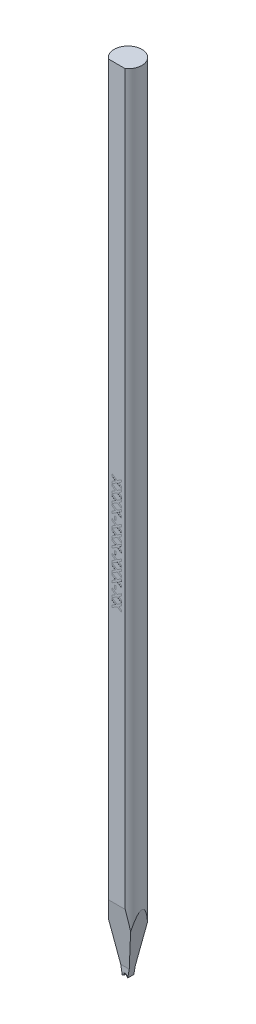
from build123d import *

# Parameters (mm, degrees)
SKETCH_TL_CUTTING_R       = 1.4986
TL_CUTTING_DEPTH          = 85.4964
SKETCH_TDF_GRINDING_W     = 3.0172
SKETCH_TDF_GRINDING_H     = 3.0172
TDF_GRINDING_DEPTH        = 86.522663762
SKETCH_ENGRAVING_W        = 0.166666667
SKETCH_ENGRAVING_H        = 0.371794872
ENGRAVING_DEPTH           = 0.005
VW_VR_GRINDING_DEPTH      = 1.5086
VW_VR_GRINDING_DEPTH_BACK = 1.5086
ISA_GRINDING_DEPTH        = 1.5086
ISA_GRINDING_DEPTH_BACK   = 1.5086
PRE_FRX_BRX_DEPTH         = 1.5086
PRE_FRX_BRX_DEPTH_BACK    = 1.5086
SKETCH_PRE_FRX_BRX_W      = 1.18348
SKETCH_PRE_FRX_BRX_H      = 0.89916
FR_EDM_R                  = 0.14986
BR_EDM_R                  = 0.14986
FA_BA_GRINDING_DEPTH      = 1.5086
FA_BA_GRINDING_DEPTH_BACK = 1.5086


with BuildPart() as part:
    # sketch_TL_cutting → TL_cutting (new body)
    with BuildSketch(Plane(origin=(0, 0, 0), x_dir=(1, 0, 0), z_dir=(0, 1, 0))):
        Circle(SKETCH_TL_CUTTING_R)
    extrude(amount=TL_CUTTING_DEPTH)

    # sketch_TDF_grinding → TDF_grinding (cut, through all)
    with BuildSketch(Plane(origin=(0, 0, 0), x_dir=(1, 0, 0), z_dir=(0, 1, 0))):
        with Locations((0, -2.71002)):
            Rectangle(SKETCH_TDF_GRINDING_W, SKETCH_TDF_GRINDING_H)
    extrude(amount=TDF_GRINDING_DEPTH, mode=Mode.SUBTRACT)

    # sketch_engraving → engraving (cut)
    with BuildSketch(Plane.XY.offset(1.20142)):
        Polygon((-0.5, 47.016609744), (0.029647436, 46.673861346), (0.5, 46.978148205), (0.5, 46.75338859), (0.203325321, 46.561481538), (0.5, 46.369574487), (0.5, 46.144814872), (0.029647436, 46.449101731), (-0.5, 46.106353333), (-0.5, 46.331112949), (-0.144030449, 46.561481538), (-0.5, 46.791850128), align=None)
        Polygon((-0.5, 46.093532821), (0.029647436, 45.750784423), (0.5, 46.055071282), (0.5, 45.830311667), (0.203325321, 45.638404615), (0.5, 45.446497564), (0.5, 45.221737949), (0.029647436, 45.526024808), (-0.5, 45.18327641), (-0.5, 45.408036026), (-0.144030449, 45.638404615), (-0.5, 45.868773205), align=None)
        Polygon((-0.5, 45.170455897), (0.029647436, 44.8277075), (0.5, 45.131994359), (0.5, 44.907234744), (0.203325321, 44.715327692), (0.5, 44.523420641), (0.5, 44.298661026), (0.029647436, 44.602947885), (-0.5, 44.260199487), (-0.5, 44.484959103), (-0.144030449, 44.715327692), (-0.5, 44.945696282), align=None)
        Polygon((-0.5, 44.247378974), (0.029647436, 43.904630577), (0.5, 44.208917436), (0.5, 43.984157821), (0.203325321, 43.792250769), (0.5, 43.600343718), (0.5, 43.375584103), (0.029647436, 43.679870962), (-0.5, 43.337122564), (-0.5, 43.561882179), (-0.144030449, 43.792250769), (-0.5, 44.022619359), align=None)
        with Locations((-0.147435898, 43.067891795)):
            Rectangle(SKETCH_ENGRAVING_W, SKETCH_ENGRAVING_H)
        Polygon((-0.5, 42.86276359), (0.029647436, 42.520015192), (0.5, 42.824302051), (0.5, 42.599542436), (0.203325321, 42.407635385), (0.5, 42.215728333), (0.5, 41.990968718), (0.029647436, 42.295255577), (-0.5, 41.952507179), (-0.5, 42.177266795), (-0.144030449, 42.407635385), (-0.5, 42.638003974), align=None)
        Polygon((-0.5, 41.939686667), (0.029647436, 41.596938269), (0.5, 41.901225128), (0.5, 41.676465513), (0.203325321, 41.484558462), (0.5, 41.29265141), (0.5, 41.067891795), (0.029647436, 41.372178654), (-0.5, 41.029430256), (-0.5, 41.254189872), (-0.144030449, 41.484558462), (-0.5, 41.714927051), align=None)
        Polygon((-0.5, 41.016609744), (0.029647436, 40.673861346), (0.5, 40.978148205), (0.5, 40.75338859), (0.203325321, 40.561481538), (0.5, 40.369574487), (0.5, 40.144814872), (0.029647436, 40.449101731), (-0.5, 40.106353333), (-0.5, 40.331112949), (-0.144030449, 40.561481538), (-0.5, 40.791850128), align=None)
        with Locations((-0.147435898, 39.837122564)):
            Rectangle(SKETCH_ENGRAVING_W, SKETCH_ENGRAVING_H)
        Polygon((-0.5, 39.631994359), (0.029647436, 39.289245962), (0.5, 39.593532821), (0.5, 39.368773205), (0.203325321, 39.176866154), (0.5, 38.984959103), (0.5, 38.760199487), (0.029647436, 39.064486346), (-0.5, 38.721737949), (-0.5, 38.946497564), (-0.144030449, 39.176866154), (-0.5, 39.407234744), align=None)
        Polygon((-0.5, 38.708917436), (0.029647436, 38.366169038), (0.5, 38.670455897), (0.5, 38.445696282), (0.203325321, 38.253789231), (0.5, 38.061882179), (0.5, 37.837122564), (0.029647436, 38.141409423), (-0.5, 37.798661026), (-0.5, 38.023420641), (-0.144030449, 38.253789231), (-0.5, 38.484157821), align=None)
        Polygon((-0.5, 37.785840513), (0.029647436, 37.443092115), (0.5, 37.747378974), (0.5, 37.522619359), (0.203325321, 37.330712308), (0.5, 37.138805256), (0.5, 36.914045641), (0.029647436, 37.2183325), (-0.5, 36.875584103), (-0.5, 37.100343718), (-0.144030449, 37.330712308), (-0.5, 37.561080897), align=None)
        with Locations((-0.147435898, 36.606353333)):
            Rectangle(SKETCH_ENGRAVING_W, SKETCH_ENGRAVING_H)
        Polygon((-0.5, 36.401225128), (0.029647436, 36.058476731), (0.5, 36.36276359), (0.5, 36.138003974), (0.203325321, 35.946096923), (0.5, 35.754189872), (0.5, 35.529430256), (0.029647436, 35.833717115), (-0.5, 35.490968718), (-0.5, 35.715728333), (-0.144030449, 35.946096923), (-0.5, 36.176465513), align=None)
        Polygon((-0.5, 35.478148205), (0.029647436, 35.135399808), (0.5, 35.439686667), (0.5, 35.214927051), (0.203325321, 35.02302), (0.5, 34.831112949), (0.5, 34.606353333), (0.029647436, 34.910640192), (-0.5, 34.567891795), (-0.5, 34.79265141), (-0.144030449, 35.02302), (-0.5, 35.25338859), align=None)
    extrude(amount=-ENGRAVING_DEPTH, mode=Mode.SUBTRACT)

    # sketch_VW_VR_grinding → VW_VR_grinding (cut, two sides: drawn at the far end of the back side and taken through both)
    with BuildSketch(Plane.XY.offset(-VW_VR_GRINDING_DEPTH_BACK)):
        with BuildLine():
            Line((-1.4936, -0.01), (-1.4936, 0.88416))
            ThreePointArc((-1.4936, 0.88416), (-1.495064466, 0.887695534), (-1.4986, 0.88916))
            Line((-1.4986, 0.88916), (-1.5086, 0.88916))
            Line((-1.5086, 0.88916), (-1.5086, -0.01))
            Line((-1.5086, -0.01), (-1.4936, -0.01))
        make_face()
        with BuildLine():
            Line((1.4936, -0.01), (1.4936, 0.88416))
            ThreePointArc((1.4936, 0.88416), (1.495064466, 0.887695534), (1.4986, 0.88916))
            Line((1.4986, 0.88916), (1.5086, 0.88916))
            Line((1.5086, 0.88916), (1.5086, -0.01))
            Line((1.5086, -0.01), (1.4936, -0.01))
        make_face()
    extrude(amount=VW_VR_GRINDING_DEPTH + VW_VR_GRINDING_DEPTH_BACK, mode=Mode.SUBTRACT)

    # sketch_ISA_grinding → ISA_grinding (cut, two sides: drawn at the far end of the back side and taken through both)
    with BuildSketch(Plane.XY.offset(-ISA_GRINDING_DEPTH_BACK)):
        Polygon((-0.29972, 0), (-1.5086, 6.855899166), (-1.5086, -0.01), (1.5086, -0.01), (1.5086, 6.855899166), (0.29972, 0), align=None)
    extrude(amount=ISA_GRINDING_DEPTH + ISA_GRINDING_DEPTH_BACK, mode=Mode.SUBTRACT)

    # sketch_pre_FRX_BRX → pre_FRX_BRX (cut, two sides: drawn at the far end of the back side and taken through both)
    with BuildSketch(Plane(origin=(0, 0, 0), x_dir=(0, 0, -1), z_dir=(1, 0, 0)).offset(-PRE_FRX_BRX_DEPTH_BACK)):
        with Locations((-0.91686, 0.43958)):
            Rectangle(SKETCH_PRE_FRX_BRX_W, SKETCH_PRE_FRX_BRX_H)
        with Locations((0.91686, 0.43958)):
            Rectangle(SKETCH_PRE_FRX_BRX_W, SKETCH_PRE_FRX_BRX_H)
    extrude(amount=PRE_FRX_BRX_DEPTH + PRE_FRX_BRX_DEPTH_BACK, mode=Mode.SUBTRACT)

    # V-Groove_EDM: sweep along a path in sketch_contour_V-Groove
    with BuildLine(Plane(origin=(0, 0, 0), x_dir=(0, 0, -1), z_dir=(1, 0, 0))) as v_groove_edm_path:
        Line((-1.20142, 0.1905), (0, 0.1905))
        Line((0, 0.1905), (1.4986, 0.1905))
    # sketch_section_V-Groove → V-Groove_EDM (sweep, cut)
    with BuildSketch(Plane.XY.offset(1.20142)):
        with BuildLine():
            Line((-1.49899536, -1.905), (-0.049898839, 0.164524309))
            ThreePointArc((-0.049898839, 0.164524309), (0, 0.1905), (0.049898839, 0.164524309))
            Line((0.049898839, 0.164524309), (1.49899536, -1.905))
            Line((1.49899536, -1.905), (-1.49899536, -1.905))
        make_face()
    sweep(path=v_groove_edm_path.line, mode=Mode.SUBTRACT)

    # FR_EDM
    fr_edm_edges = [part.edges().sort_by_distance(p)[0] for p in [
        (0.107499419, 0.082262154, 0.32512),
        (0, 0.1905, 0.32512),
        (-0.107499419, 0.082262154, 0.32512),
    ]]
    fillet(fr_edm_edges, radius=FR_EDM_R)

    # BR_EDM
    br_edm_edges = [part.edges().sort_by_distance(p)[0] for p in [
        (0.107499419, 0.082262154, -0.32512),
        (0, 0.1905, -0.32512),
        (-0.107499419, 0.082262154, -0.32512),
    ]]
    fillet(br_edm_edges, radius=BR_EDM_R)

    # sketch_FA_BA_grinding → FA_BA_grinding (cut, two sides: drawn at the far end of the back side and taken through both)
    with BuildSketch(Plane(origin=(0, 0, 0), x_dir=(0, 0, -1), z_dir=(1, 0, 0)).offset(-FA_BA_GRINDING_DEPTH_BACK)):
        Polygon((2.4986, 16.364273784), (2.4986, -0.1), (0.32512, -0.1), (0.32512, 0.89916), align=None)
        Polygon((-3.272828656, 21.873196919), (-0.32512, 0.89916), (-0.32512, -0.1), (-3.272828656, -0.1), align=None)
    extrude(amount=FA_BA_GRINDING_DEPTH + FA_BA_GRINDING_DEPTH_BACK, mode=Mode.SUBTRACT)


solid = part.part
